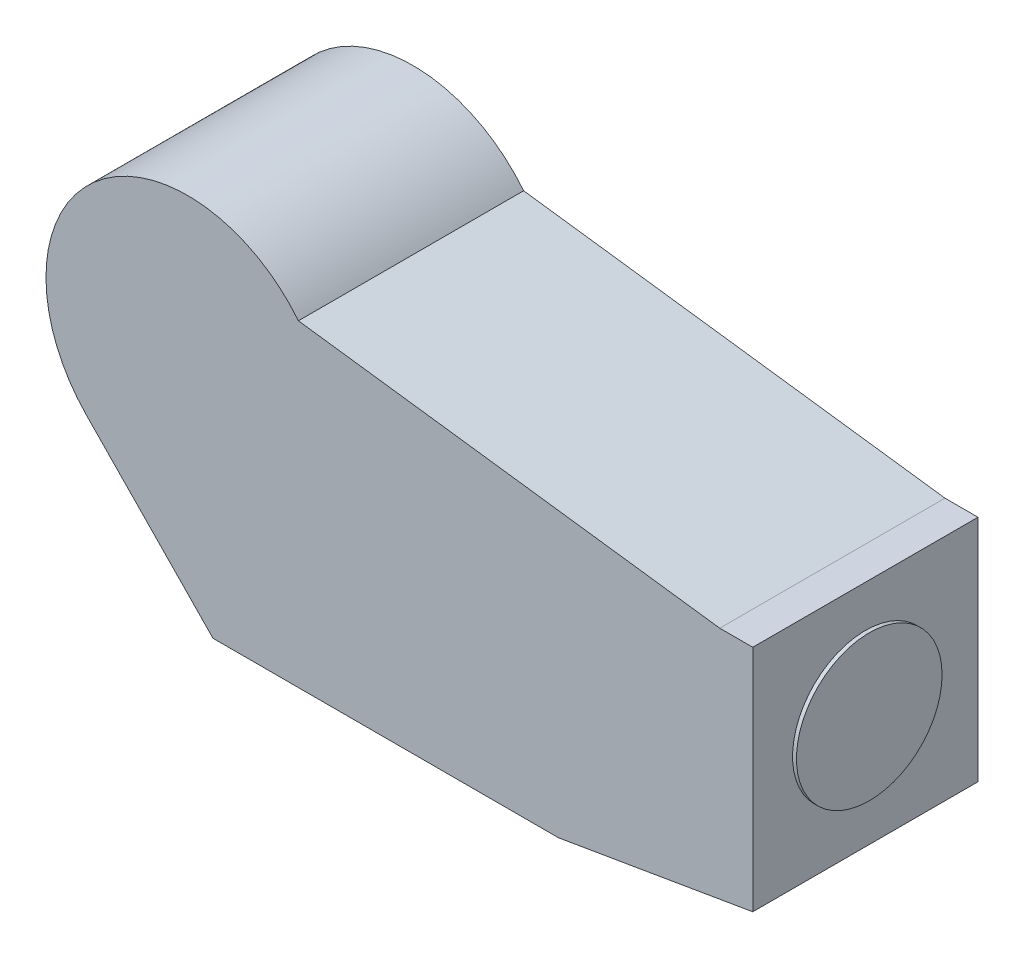
from build123d import *

# Parameters (mm, degrees)
BOSS_EXTRUDE1_DEPTH = 58
SKETCH2_R           = 37.5
BOSS_EXTRUDE2_DEPTH = 2


with BuildPart() as part:
    # Sketch1 → Boss-Extrude1 (new, symmetric)
    with BuildSketch(Plane.XY):
        with BuildLine():
            Line((291, 0), (291, 17))
            Line((291, 17), (274, 17))
            Line((274, 17), (57, 45.607017004))
            ThreePointArc((57, 45.607017004), (-48.32227677, 54.71706834), (-52.304922539, -50.92342367))
            Line((-52.304922539, -50.92342367), (13, -118))
            Line((13, -118), (191, -118))
            Line((191, -118), (291, -101))
            Line((291, -101), (291, 0))
        make_face()
    extrude(amount=BOSS_EXTRUDE1_DEPTH, both=True)

    # Sketch2 → Boss-Extrude2 (add)
    with BuildSketch(Plane(origin=(291, 0, 0), x_dir=(0, 0, -1), z_dir=(1, 0, 0))):
        with Locations((0, -42)):
            Circle(SKETCH2_R)
    extrude(amount=BOSS_EXTRUDE2_DEPTH)


solid = part.part
